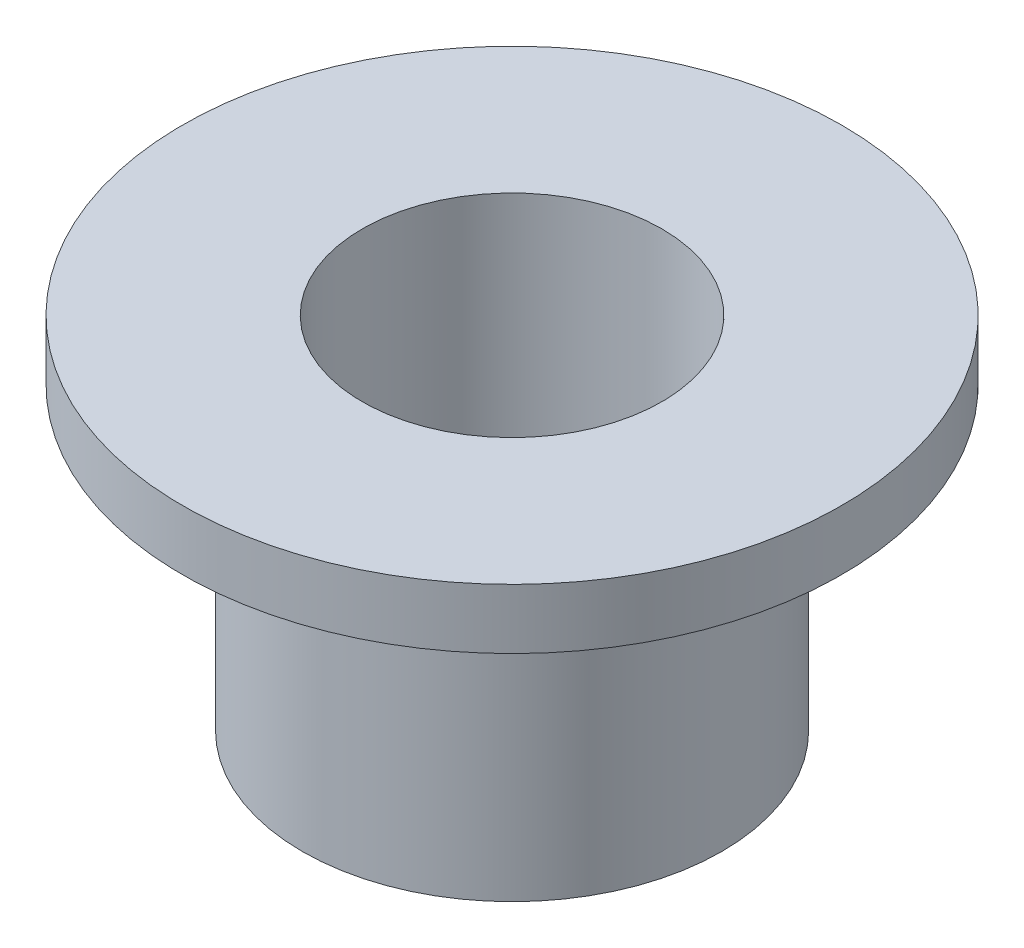
from build123d import *


with BuildPart() as part:
    # Sketch2 → Revolve1 (revolve)
    with BuildSketch(Plane.XY, mode=Mode.PRIVATE) as revolve1_sk:
        Polygon((-2.5, 0), (-2.5, 6), (-5.5, 6), (-5.5, 5), (-3.5, 5), (-3.5, 0), align=None)
    revolve(revolve1_sk.sketch.rotate(Axis((0, 0, 0), (0, 1, 0)), 270), axis=Axis((0, 0, 0), (0, 1, 0)))


solid = part.part
